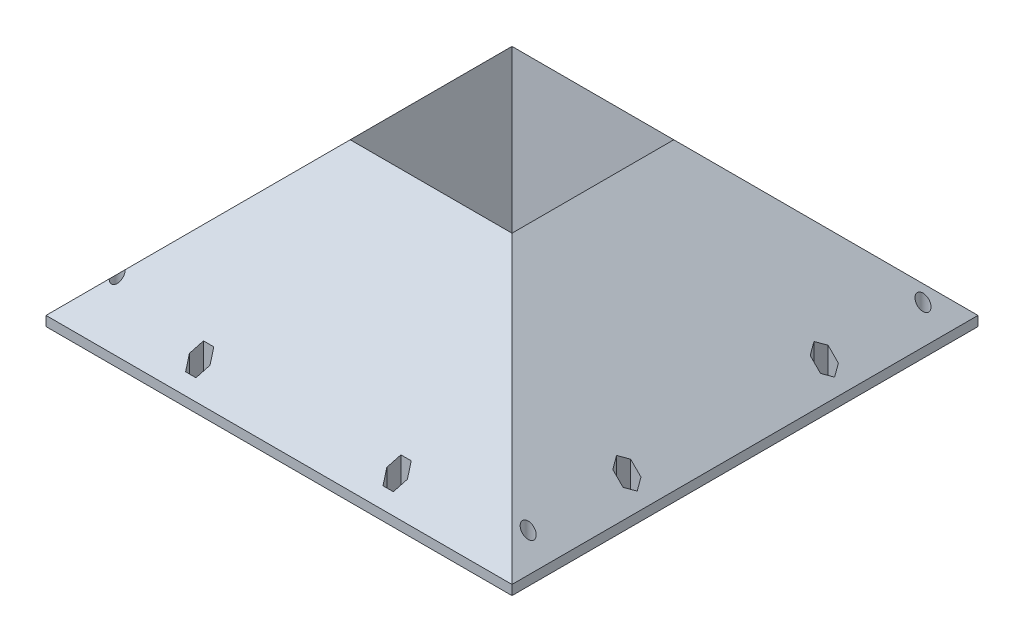
from build123d import *

# Parameters (mm, degrees)
CROQUIS1_W                 = 140
CROQUIS1_H                 = 140
CROQUIS1_R                 = 1.5
SALIENTE_EXTRUIR1_DEPTH    = 50
CROQUIS2_R                 = 1.75
CROQUIS2_W                 = 50
CROQUIS2_H                 = 50
CORTAR_EXTRUIR1_DEPTH      = 143
CROQUIS3_W                 = 144
CROQUIS3_H                 = 144
CROQUIS3_R                 = 1.75
CROQUIS3_W_2               = 50
CROQUIS3_H_2               = 50
SALIENTE_EXTRUIR3_DEPTH    = 50
CORTAR_EXTRUIR2_REACH      = 170.582
CORTAR_EXTRUIR3_DEPTH      = 92
CORTAR_EXTRUIR3_DEPTH_BACK = 78


with BuildPart() as part:
    # Croquis1 → Saliente-Extruir1 (new body)
    with BuildSketch(Plane(origin=(0, 0, 0), x_dir=(1, 0, 0), z_dir=(0, 1, 0))):
        Rectangle(CROQUIS1_W, CROQUIS1_H)
        with Locations(Location((-61, 61, 0), (0, 0, 270))):
            Circle(CROQUIS1_R, mode=Mode.SUBTRACT)
        with Locations(Location((66, 61, 0), (0, 0, 270))):
            Circle(CROQUIS1_R, mode=Mode.SUBTRACT)
        with Locations(Location((66, -61, 0), (0, 0, 270))):
            Circle(CROQUIS1_R, mode=Mode.SUBTRACT)
        with Locations(Location((-61, -61, 0), (0, 0, 270))):
            Circle(CROQUIS1_R, mode=Mode.SUBTRACT)
        with Locations(Location((66, 30.5, 0), (0, 0, 270))):
            Circle(CROQUIS1_R, mode=Mode.SUBTRACT)
        with Locations(Location((66, -30.5, 0), (0, 0, 270))):
            Circle(CROQUIS1_R, mode=Mode.SUBTRACT)
        with Locations(Location((-30.5, -66, 0), (0, 0, 270))):
            Circle(CROQUIS1_R, mode=Mode.SUBTRACT)
        with Locations(Location((30.5, -66, 0), (0, 0, 270))):
            Circle(CROQUIS1_R, mode=Mode.SUBTRACT)
        with Locations(Location((-30.5, 66, 0), (0, 0, 90))):
            Circle(CROQUIS1_R, mode=Mode.SUBTRACT)
        with Locations(Location((30.5, 66, 0), (0, 0, 90))):
            Circle(CROQUIS1_R, mode=Mode.SUBTRACT)
        with Locations(Location((-66, 30.5, 0), (0, 0, 90))):
            Circle(CROQUIS1_R, mode=Mode.SUBTRACT)
        with Locations(Location((-66, -30.5, 0), (0, 0, 90))):
            Circle(CROQUIS1_R, mode=Mode.SUBTRACT)
    extrude(amount=SALIENTE_EXTRUIR1_DEPTH)

    # Croquis2 → Cortar-Extruir1 (cut)
    with BuildSketch(Plane(origin=(0, 50, 0), x_dir=(1, 0, 0), z_dir=(0, 1, 0))):
        with Locations(Location((66, 61, 0), (0, 0, 270))):
            Circle(CROQUIS2_R)
        with Locations(Location((-61, 61, 0), (0, 0, 270))):
            Circle(CROQUIS2_R)
        with Locations(Location((-61, -61, 0), (0, 0, 270))):
            Circle(CROQUIS2_R)
        with Locations(Location((66, -61, 0), (0, 0, 270))):
            Circle(CROQUIS2_R)
        Polygon((-28.906513257, 63.24), (-27.313026514, 66), (-28.906513257, 68.76), (-32.093486743, 68.76), (-33.686973486, 66), (-32.093486743, 63.24), align=None)
        Polygon((32.093486743, 63.24), (33.686973486, 66), (32.093486743, 68.76), (28.906513257, 68.76), (27.313026514, 66), (28.906513257, 63.24), align=None)
        Polygon((67.593486743, 27.74), (69.186973486, 30.5), (67.593486743, 33.26), (64.406513257, 33.26), (62.813026514, 30.5), (64.406513257, 27.74), align=None)
        Polygon((67.593486743, -33.26), (69.186973486, -30.5), (67.593486743, -27.74), (64.406513257, -27.74), (62.813026514, -30.5), (64.406513257, -33.26), align=None)
        Polygon((32.093486743, -68.76), (33.686973486, -66), (32.093486743, -63.24), (28.906513257, -63.24), (27.313026514, -66), (28.906513257, -68.76), align=None)
        Polygon((-28.906513257, -68.76), (-27.313026514, -66), (-28.906513257, -63.24), (-32.093486743, -63.24), (-33.686973486, -66), (-32.093486743, -68.76), align=None)
        Polygon((-64.406513257, -33.26), (-62.813026514, -30.5), (-64.406513257, -27.74), (-67.593486743, -27.74), (-69.186973486, -30.5), (-67.593486743, -33.26), align=None)
        Polygon((-64.406513257, 27.74), (-62.813026514, 30.5), (-64.406513257, 33.26), (-67.593486743, 33.26), (-69.186973486, 30.5), (-67.593486743, 27.74), align=None)
        Rectangle(CROQUIS2_W, CROQUIS2_H)
    extrude(amount=-CORTAR_EXTRUIR1_DEPTH, mode=Mode.SUBTRACT)

    # Croquis3 → Saliente-Extruir3 (add)
    with BuildSketch(Plane(origin=(0, 50, 0), x_dir=(1, 0, 0), z_dir=(0, 1, 0))):
        Rectangle(CROQUIS3_W, CROQUIS3_H)
        with Locations(Location((-61, -61, 0), (0, 0, 270))):
            Circle(CROQUIS3_R, mode=Mode.SUBTRACT)
        with Locations(Location((-61, 61, 0), (0, 0, 270))):
            Circle(CROQUIS3_R, mode=Mode.SUBTRACT)
        with Locations(Location((66, 61, 0), (0, 0, 270))):
            Circle(CROQUIS3_R, mode=Mode.SUBTRACT)
        with Locations(Location((66, -61, 0), (0, 0, 270))):
            Circle(CROQUIS3_R, mode=Mode.SUBTRACT)
        Rectangle(CROQUIS3_W_2, CROQUIS3_H_2, mode=Mode.SUBTRACT)
        Polygon((-33.686973486, -66), (-32.093486743, -68.76), (-28.906513257, -68.76), (-27.313026514, -66), (-28.906513257, -63.24), (-32.093486743, -63.24), align=None, mode=Mode.SUBTRACT)
        Polygon((-67.593486743, -33.26), (-64.406513257, -33.26), (-62.813026514, -30.5), (-64.406513257, -27.74), (-67.593486743, -27.74), (-69.186973486, -30.5), align=None, mode=Mode.SUBTRACT)
        Polygon((28.906513257, 63.24), (32.093486743, 63.24), (33.686973486, 66), (32.093486743, 68.76), (28.906513257, 68.76), (27.313026514, 66), align=None, mode=Mode.SUBTRACT)
        Polygon((-33.686973486, 66), (-32.093486743, 63.24), (-28.906513257, 63.24), (-27.313026514, 66), (-28.906513257, 68.76), (-32.093486743, 68.76), align=None, mode=Mode.SUBTRACT)
        Polygon((62.813026514, 30.5), (64.406513257, 27.74), (67.593486743, 27.74), (69.186973486, 30.5), (67.593486743, 33.26), (64.406513257, 33.26), align=None, mode=Mode.SUBTRACT)
        Polygon((67.593486743, -33.26), (69.186973486, -30.5), (67.593486743, -27.74), (64.406513257, -27.74), (62.813026514, -30.5), (64.406513257, -33.26), align=None, mode=Mode.SUBTRACT)
        Polygon((33.686973486, -66), (32.093486743, -63.24), (28.906513257, -63.24), (27.313026514, -66), (28.906513257, -68.76), (32.093486743, -68.76), align=None, mode=Mode.SUBTRACT)
        Polygon((-64.406513257, 27.74), (-62.813026514, 30.5), (-64.406513257, 33.26), (-67.593486743, 33.26), (-69.186973486, 30.5), (-67.593486743, 27.74), align=None, mode=Mode.SUBTRACT)
    extrude(amount=-SALIENTE_EXTRUIR3_DEPTH)

    # Cortar-Extruir2: up to this face of the body (flat: up to its plane)
    cortar_extruir2_end = Plane(part.part.faces().sort_by_distance((72, 25, 0))[0])
    # Croquis4 → Cortar-Extruir2 (cut, up to the picked face)
    with BuildSketch(Plane.ZY.offset(72), mode=Mode.PRIVATE) as cortar_extruir2_sk1:
        Polygon((-25, 50), (-72, 3), (-72, 50), align=None)
    cortar_extruir2_tool1 = split(extrude(cortar_extruir2_sk1.sketch, amount=-CORTAR_EXTRUIR2_REACH, mode=Mode.PRIVATE), bisect_by=cortar_extruir2_end, keep=Keep.BOTH, mode=Mode.PRIVATE)
    # Croquis4 → Cortar-Extruir2 (cut, up to the picked face)
    with BuildSketch(Plane.ZY.offset(72), mode=Mode.PRIVATE) as cortar_extruir2_sk2:
        Polygon((72, 3), (72, 50), (25, 50), align=None)
    cortar_extruir2_tool2 = split(extrude(cortar_extruir2_sk2.sketch, amount=-CORTAR_EXTRUIR2_REACH, mode=Mode.PRIVATE), bisect_by=cortar_extruir2_end, keep=Keep.BOTH, mode=Mode.PRIVATE)
    add(cortar_extruir2_tool1.solids().sort_by(Axis((-72, 34.333333, -56.333333), (1, 0, 0)))[0], mode=Mode.SUBTRACT)
    add(cortar_extruir2_tool2.solids().sort_by(Axis((-72, 34.333333, 56.333333), (1, 0, 0)))[0], mode=Mode.SUBTRACT)

    # Croquis5 → Cortar-Extruir3 (cut, two sides: drawn at the far end of the back side and taken through both)
    with BuildSketch(Plane.XY.offset(-CORTAR_EXTRUIR3_DEPTH_BACK)):
        Polygon((-25, 50), (-72, 3), (-72, 50), align=None)
        Polygon((25, 50), (72, 3), (72, 50), align=None)
    extrude(amount=CORTAR_EXTRUIR3_DEPTH + CORTAR_EXTRUIR3_DEPTH_BACK, mode=Mode.SUBTRACT)


solid = part.part
